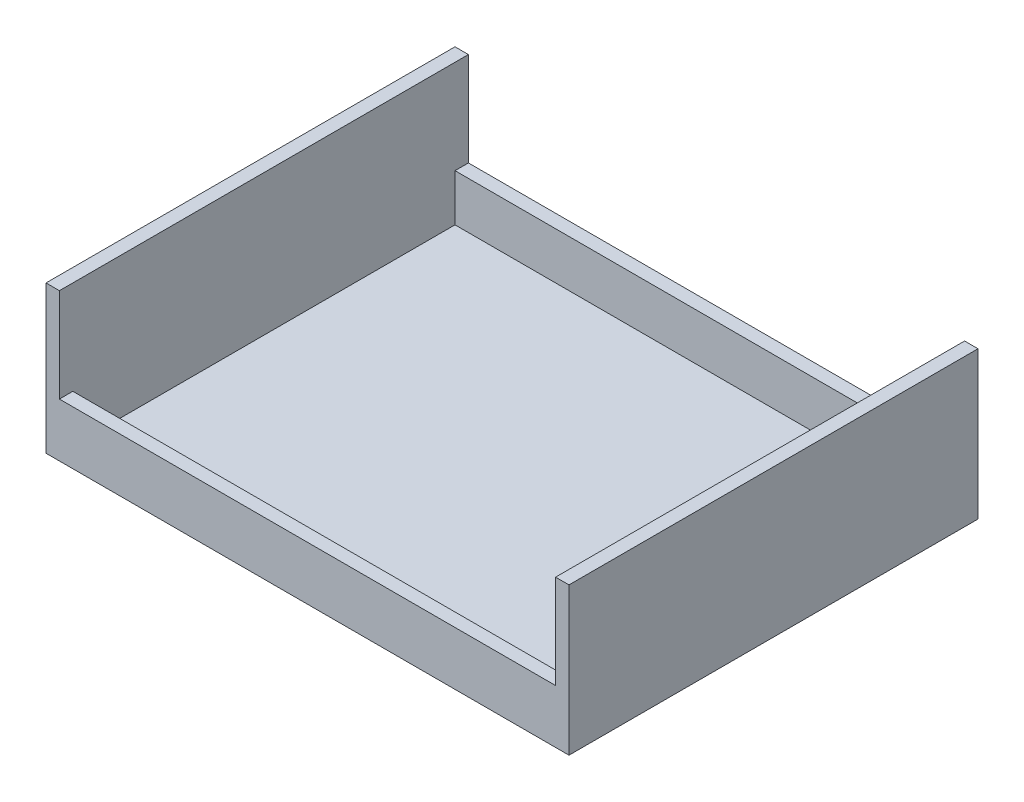
from build123d import *

# Parameters (mm, degrees)
SKETCH2_W           = 78
SKETCH2_H           = 61
BOSS_EXTRUDE1_DEPTH = 1
SKETCH3_W           = 2
SKETCH3_H           = 61
BOSS_EXTRUDE2_DEPTH = 21
SKETCH4_W           = 74
SKETCH4_H           = 2
BOSS_EXTRUDE3_DEPTH = 7


with BuildPart() as part:
    # Sketch2 → Boss-Extrude1 (new body)
    with BuildSketch(Plane(origin=(0, 0, 0), x_dir=(1, 0, 0), z_dir=(0, 1, 0))):
        with Locations((39, 30.5)):
            Rectangle(SKETCH2_W, SKETCH2_H)
    extrude(amount=BOSS_EXTRUDE1_DEPTH)

    # Sketch3 → Boss-Extrude2 (add)
    with BuildSketch(Plane(origin=(0, 1, 0), x_dir=(1, 0, 0), z_dir=(0, 1, 0))):
        with Locations((1, 30.5)):
            Rectangle(SKETCH3_W, SKETCH3_H)
        with Locations((77, 30.5)):
            Rectangle(SKETCH3_W, SKETCH3_H)
    extrude(amount=BOSS_EXTRUDE2_DEPTH)

    # Sketch4 → Boss-Extrude3 (add)
    with BuildSketch(Plane(origin=(0, 1, 0), x_dir=(1, 0, 0), z_dir=(0, 1, 0))):
        with Locations((39, 1)):
            Rectangle(SKETCH4_W, SKETCH4_H)
        with Locations((39, 60)):
            Rectangle(SKETCH4_W, SKETCH4_H)
    extrude(amount=BOSS_EXTRUDE3_DEPTH)


solid = part.part
